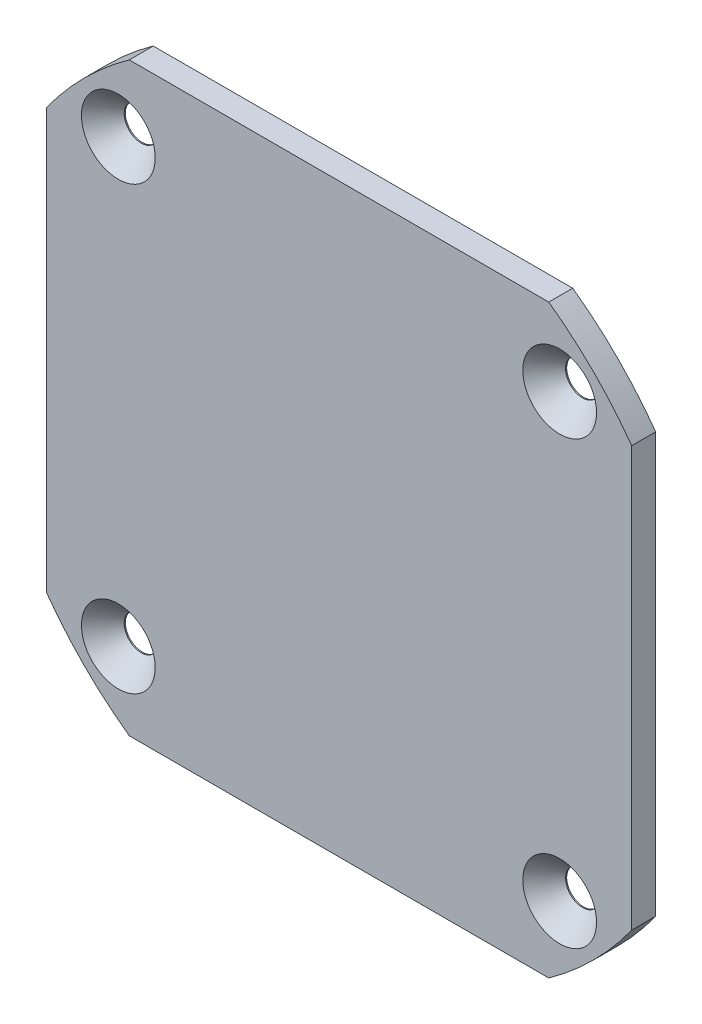
from build123d import *

# Parameters (mm, degrees)
SKETCH1_R           = 47.625
BOSS_EXTRUDE1_DEPTH = 3.175
CIRPATTERN1_COUNT   = 4
SKETCH6_OUTSIDE_W   = 124.198
SKETCH6_OUTSIDE_H   = 124.198
SKETCH6_OUTSIDE_W_2 = 77.421664786
SKETCH6_OUTSIDE_H_2 = 77.421664786
CUT_EXTRUDE2_DEPTH  = 68.426714847


with BuildPart() as part:
    # Sketch1 → Boss-Extrude1 (new body)
    with BuildSketch(Plane.XY):
        Circle(SKETCH1_R)
    extrude(amount=BOSS_EXTRUDE1_DEPTH)

    # Sketch3 → CSK for #8 Flat Head Machine Screw1 (revolve, cut)
    with BuildSketch(Plane(origin=(29.185832393, 29.185832393, 3.175), x_dir=(0, -1, 0), z_dir=(1, 0, 0))):
        Polygon((0, 0), (0, 3.175), (2.2479, 3.175), (2.2479, 3.026511835), (4.8788066, 0), align=None)
    csk_for_8_flat_head_machine_screw1 = revolve(axis=Axis((29.185832393, 29.185832393, 9.525), (0, 0, -1)), mode=Mode.SUBTRACT)

    # CirPattern1: CSK for #8 Flat Head Machine Screw1 ×4 about axis
    cirpattern1_axis = Axis((0, 0, 0), (0, 0, 1))
    for i in range(1, CIRPATTERN1_COUNT):
        add(csk_for_8_flat_head_machine_screw1.rotate(cirpattern1_axis, i * 360 / CIRPATTERN1_COUNT), mode=Mode.SUBTRACT)

    # Sketch6 outside → Cut-Extrude2 (cut, through all)
    with BuildSketch(Plane.XY.offset(3.175)):
        Rectangle(SKETCH6_OUTSIDE_W, SKETCH6_OUTSIDE_H)
        Rectangle(SKETCH6_OUTSIDE_W_2, SKETCH6_OUTSIDE_H_2, mode=Mode.SUBTRACT)
    extrude(amount=-CUT_EXTRUDE2_DEPTH, mode=Mode.SUBTRACT)


solid = part.part
